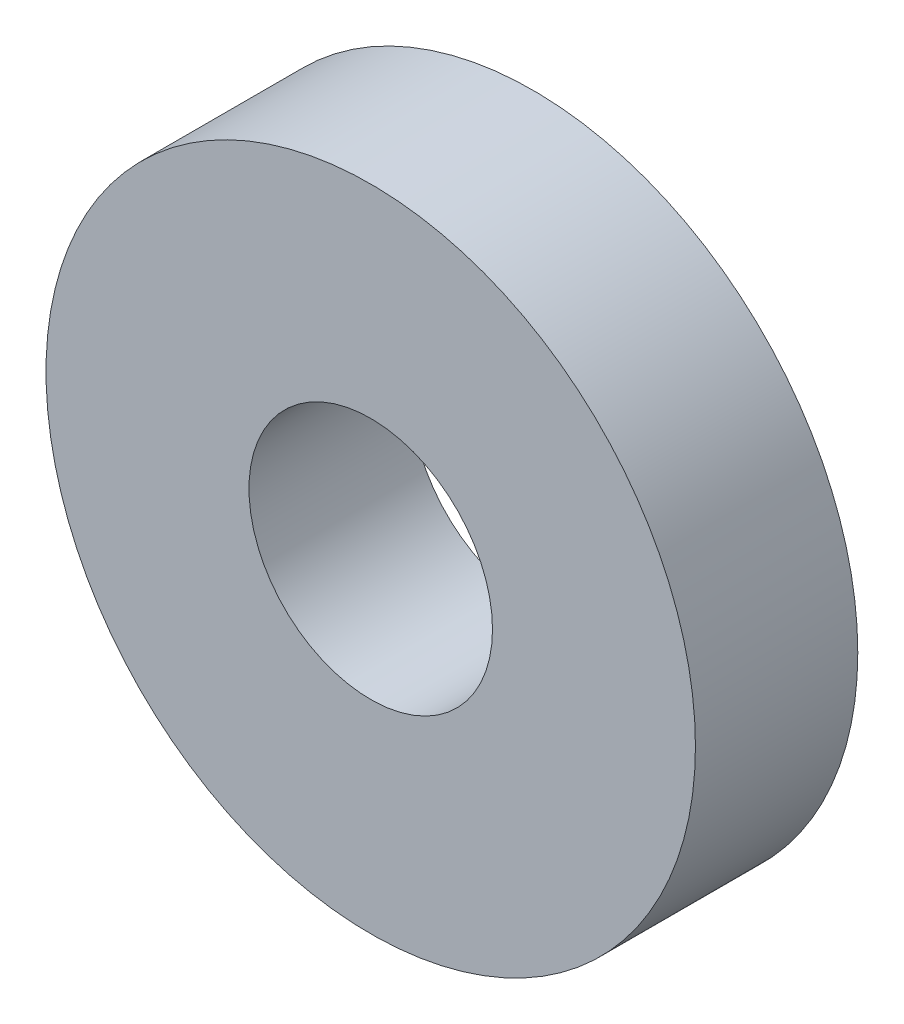
from build123d import *

# Parameters (mm, degrees)
SKETCH1_R           = 6.35
SKETCH1_R_2         = 2.38125
BOSS_EXTRUDE1_DEPTH = 3.175


with BuildPart() as part:
    # Sketch1 → Boss-Extrude1 (new body)
    with BuildSketch(Plane.XY):
        Circle(SKETCH1_R)
        Circle(SKETCH1_R_2, mode=Mode.SUBTRACT)
    extrude(amount=BOSS_EXTRUDE1_DEPTH)


solid = part.part
